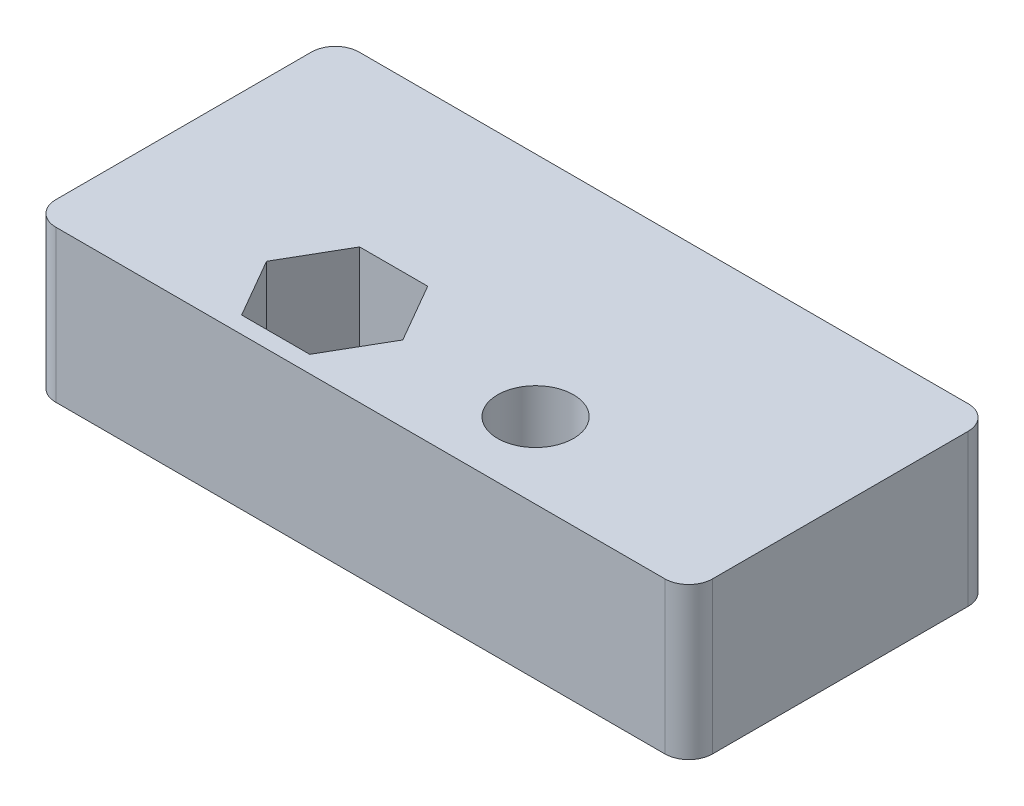
from build123d import *

# Parameters (mm, degrees)
SKETCH1_W           = 27.5
SKETCH1_H           = 12.7
SKETCH1_R           = 1.5875
BOSS_EXTRUDE1_DEPTH = 6.35
FILLET1_R           = 1


with BuildPart() as part:
    # Sketch1 → Boss-Extrude1 (new body)
    with BuildSketch(Plane(origin=(0, 0, 0), x_dir=(1, 0, 0), z_dir=(0, 1, 0))):
        with Locations((13.75, 6.35)):
            Rectangle(SKETCH1_W, SKETCH1_H)
        with Locations(Location((17.9125, 3.175, 0), (0, 0, 270))):
            Circle(SKETCH1_R, mode=Mode.SUBTRACT)
        Polygon((12.352283535, 3.175), (10.926141767, 5.64515), (8.073858233, 5.64515), (6.647716465, 3.175), (8.073858233, 0.70485), (10.926141767, 0.70485), align=None, mode=Mode.SUBTRACT)
    extrude(amount=BOSS_EXTRUDE1_DEPTH)

    # Fillet1
    fillet1_edges = [part.edges().sort_by_distance(p)[0] for p in [
        (0, 3.175, -12.7),
        (27.5, 3.175, -12.7),
        (27.5, 3.175, 0),
        (0, 3.175, 0),
    ]]
    fillet(fillet1_edges, radius=FILLET1_R)


solid = part.part
